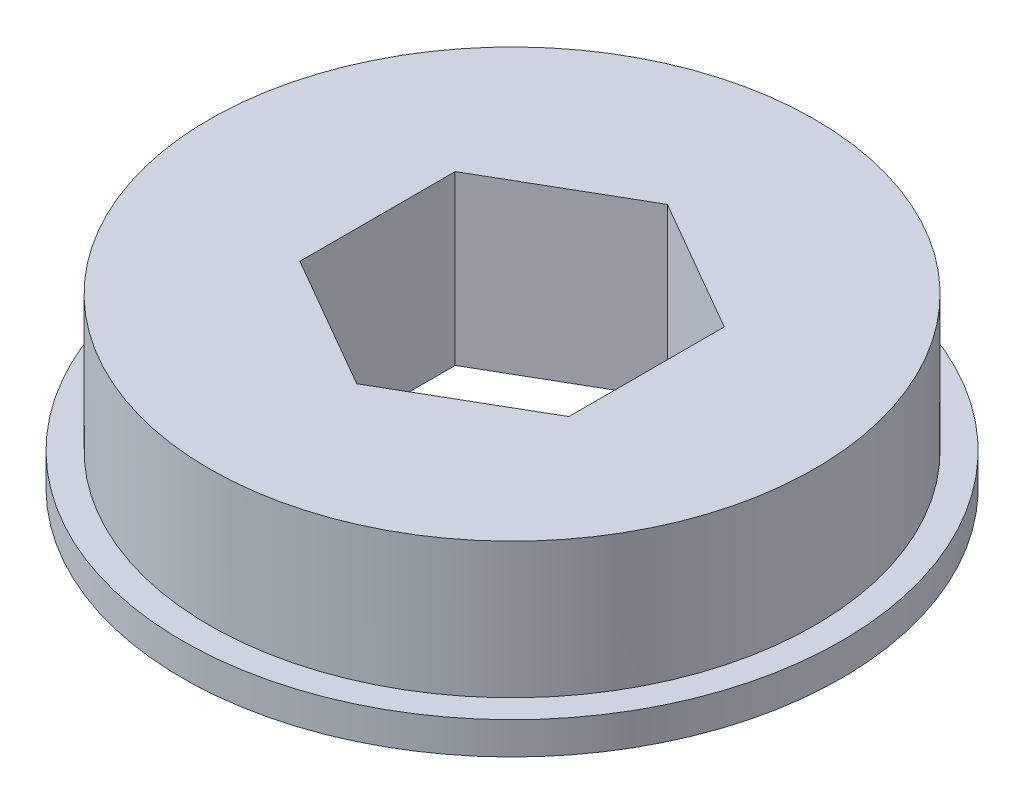
from build123d import *

# Parameters (mm, degrees)
SKETCH1_R           = 14.2875
BOSS_EXTRUDE1_DEPTH = 7.9248
SKETCH2_R           = 15.5575
SKETCH2_R_2         = 14.2875
BOSS_EXTRUDE2_DEPTH = 1.524


with BuildPart() as part:
    # Sketch1 → Boss-Extrude1 (new body)
    with BuildSketch(Plane(origin=(0, 0, 0), x_dir=(1, 0, 0), z_dir=(0, 1, 0))):
        with Locations(Location((0, 0, 0), (0, 0, 270))):
            Circle(SKETCH1_R)
        Polygon((6.35, -3.666174209), (6.35, 3.666174209), (0, 7.332348419), (-6.35, 3.666174209), (-6.35, -3.666174209), (0, -7.332348419), align=None, mode=Mode.SUBTRACT)
    extrude(amount=BOSS_EXTRUDE1_DEPTH)

    # Sketch2 → Boss-Extrude2 (add)
    with BuildSketch(Plane.XZ):
        with Locations(Location((0, 0, 0), (0, 0, 270))):
            Circle(SKETCH2_R)
        with Locations(Location((0, 0, 0), (0, 0, 270))):
            Circle(SKETCH2_R_2, mode=Mode.SUBTRACT)
    extrude(amount=-BOSS_EXTRUDE2_DEPTH)


solid = part.part
